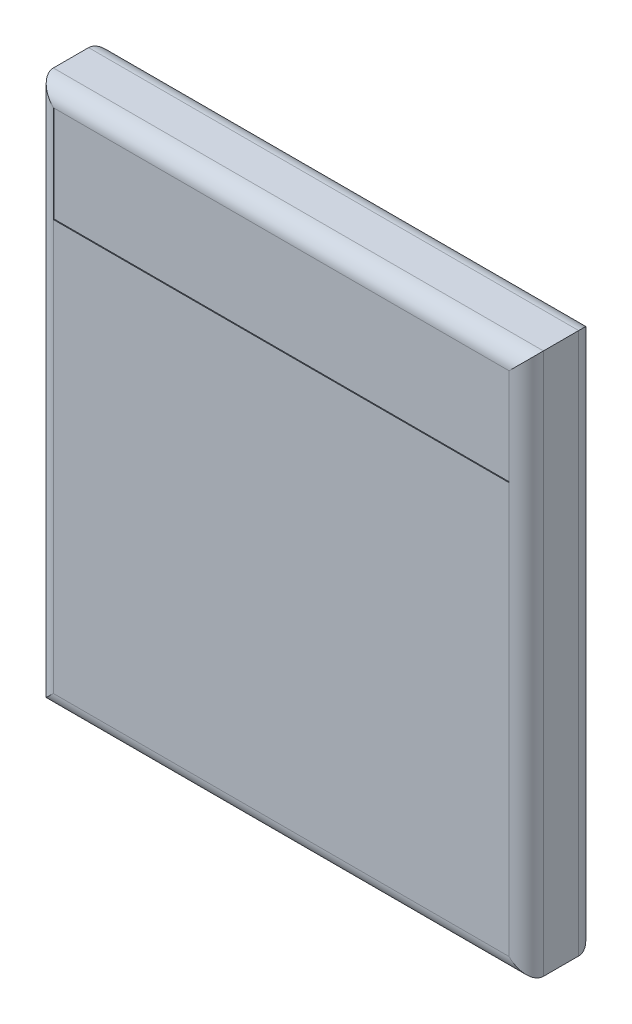
from build123d import *

# Parameters (mm, degrees)
BOSS_EXTRU_1_DEPTH      = 4.05
BOSS_EXTRU_1_DEPTH_BACK = 4.05
ESQUISSE1_W             = 57
ESQUISSE1_H             = 63
CONG_1_R                = 2
ESQUISSE3_W             = 53
ESQUISSE3_H             = 11.26901874
ENL_V_MAT_EXTRU_1_DEPTH = 0.1
ESQUISSE4_W             = 53
ESQUISSE4_H             = 11.26901874
ENL_V_MAT_EXTRU_2_DEPTH = 0.1
ENL_V_MAT_EXTRU_3_DEPTH = 0.1


with BuildPart() as part:
    # Esquisse1 → Boss.-Extru.1 (new, two sides: drawn at the far end of the back side and taken through both)
    with BuildSketch(Plane.XY.offset(-BOSS_EXTRU_1_DEPTH_BACK)):
        Rectangle(ESQUISSE1_W, ESQUISSE1_H)
    extrude(amount=BOSS_EXTRU_1_DEPTH + BOSS_EXTRU_1_DEPTH_BACK)

    # Congé1
    cong_1_edges = [part.edges().sort_by_distance(p)[0] for p in [
        (28.5, 0, 4.05),
        (-28.5, 0, -4.05),
        (0, 31.5, 4.05),
        (-28.5, 0, 4.05),
        (0, -31.5, 4.05),
        (0, -31.5, -4.05),
        (28.5, 0, -4.05),
        (0, 31.5, -4.05),
    ]]
    fillet(cong_1_edges, radius=CONG_1_R)

    # Esquisse3 → Enlèv. mat.-Extru.1 (cut)
    with BuildSketch(Plane(origin=(0, 0, -4.05), x_dir=(-1, 0, 0), z_dir=(0, 0, -1))):
        with Locations((0, 23.86549063)):
            Rectangle(ESQUISSE3_W, ESQUISSE3_H)
    extrude(amount=-ENL_V_MAT_EXTRU_1_DEPTH, mode=Mode.SUBTRACT)

    # Esquisse4 → Enlèv. mat.-Extru.2 (cut)
    with BuildSketch(Plane.XY.offset(4.05)):
        with Locations((0, 23.86549063)):
            Rectangle(ESQUISSE4_W, ESQUISSE4_H)
    extrude(amount=-ENL_V_MAT_EXTRU_2_DEPTH, mode=Mode.SUBTRACT)

    # Esquisse5 → Enlèv. mat.-Extru.3 (cut)
    # profile 1 of 7: a face of its own
    with BuildSketch(Plane(origin=(0, 0, -4.05), x_dir=(-1, 0, 0), z_dir=(0, 0, -1))):
        with BuildLine():
            Line((-11.232701207, 13.195449506), (-11.546803771, 13.195449506))
            add(Edge.make_bspline(
                [(-11.546803771, 13.195449506), (-11.53829422, 13.23068199), (-11.521658745, 13.299558614), (-11.486961171, 13.397965875), (-11.449161916, 13.491089396), (-11.403772811, 13.57718547), (-11.354264057, 13.657984373), (-11.297541336, 13.731653497), (-11.236221613, 13.800066463), (-11.168396664, 13.8607797), (-11.097268002, 13.915757429), (-11.021833382, 13.962632487), (-10.943610489, 14.00295664), (-10.862057356, 14.036176871), (-10.776931184, 14.061202395), (-10.689001561, 14.079359201), (-10.598038061, 14.091150315), (-10.53629047, 14.092301078), (-10.504936784, 14.092885403)],
                knots=[0, 0, 0, 0, 1.162005537, 2.271625781, 3.343758855, 4.383309926, 5.390229558, 6.379919256, 7.361854164, 8.333198761, 9.295911338, 10.242430842, 11.177959212, 12.116337295, 13.062827104, 14.020064771, 14.994644689, 16, 16, 16, 16], degree=3))
            add(Edge.make_bspline(
                [(-10.504936784, 14.092885403), (-10.459254042, 14.091506173), (-10.368885031, 14.088777797), (-10.236121984, 14.063863361), (-10.108095165, 14.024438229), (-9.986205917, 13.969964501), (-9.872987484, 13.902777188), (-9.772251297, 13.822812451), (-9.685362787, 13.73161315), (-9.612468409, 13.630880586), (-9.55539341, 13.523225076), (-9.513307036, 13.412424919), (-9.487685355, 13.298742948), (-9.484364799, 13.221985668), (-9.482701207, 13.183530435)],
                knots=[0, 0, 0, 0, 1.083050992, 2.142477498, 3.193116406, 4.255571735, 5.30263384, 6.308962982, 7.297363603, 8.282367274, 9.249857812, 10.179914175, 11.08814088, 12, 12, 12, 12], degree=3))
            add(Edge.make_bspline(
                [(-9.482701207, 13.183530435), (-9.483864798, 13.14652364), (-9.486141765, 13.074107086), (-9.50547547, 12.968385589), (-9.538011733, 12.868743989), (-9.583081496, 12.774762826), (-9.641423046, 12.687037987), (-9.712095743, 12.605372096), (-9.795598405, 12.529402938), (-9.858877343, 12.485883465), (-9.891455213, 12.463478352)],
                knots=[0, 0, 0, 0, 1.024540389, 2.004866551, 2.965041327, 3.920577974, 4.882998113, 5.874504559, 6.905732034, 8, 8, 8, 8], degree=3))
            add(Edge.make_bspline(
                [(-9.891455213, 12.463478352), (-9.854223459, 12.44550018), (-9.780456584, 12.409880223), (-9.679906055, 12.340024465), (-9.588628179, 12.259368118), (-9.53772446, 12.196425465), (-9.512148322, 12.164800467)],
                knots=[0, 0, 0, 0, 1.015518401, 2.012035669, 3.001164323, 4, 4, 4, 4], degree=3))
            add(Edge.make_bspline(
                [(-9.512148322, 12.164800467), (-9.49530698, 12.141742716), (-9.461900084, 12.096004799), (-9.42066455, 12.022468373), (-9.383255436, 11.948116884), (-9.354105216, 11.870957478), (-9.331531349, 11.791884464), (-9.315395317, 11.710762068), (-9.305371176, 11.627524046), (-9.303935624, 11.571211565), (-9.303214027, 11.542905435)],
                knots=[0, 0, 0, 0, 1.025084078, 2.033381695, 3.024893161, 4.013698104, 4.991890475, 5.976764909, 6.982997093, 8, 8, 8, 8], degree=3))
            add(Edge.make_bspline(
                [(-9.303214027, 11.542905435), (-9.305008541, 11.493895714), (-9.308589123, 11.396106912), (-9.340593197, 11.25163219), (-9.390206438, 11.110406688), (-9.460663374, 10.975331849), (-9.546530883, 10.848951468), (-9.648688207, 10.735875159), (-9.765974615, 10.638676555), (-9.896780264, 10.557466327), (-10.038497392, 10.492548404), (-10.190072984, 10.447490961), (-10.349323038, 10.418144962), (-10.458530336, 10.414998093), (-10.514051367, 10.413398224)],
                knots=[0, 0, 0, 0, 0.955779014, 1.907060117, 2.875433937, 3.871313158, 4.872415639, 5.851225146, 6.836215519, 7.83643374, 8.849228613, 9.86973379, 10.916971861, 12, 12, 12, 12], degree=3))
            add(Edge.make_bspline(
                [(-10.514051367, 10.413398224), (-10.551470667, 10.414266437), (-10.625099372, 10.415974791), (-10.733342871, 10.427653392), (-10.83666457, 10.448983397), (-10.935204168, 10.477686703), (-11.029049204, 10.514078445), (-11.117913309, 10.559397143), (-11.202343203, 10.612708645), (-11.281542154, 10.674642233), (-11.355500722, 10.743923573), (-11.422253446, 10.821782583), (-11.482913239, 10.906779986), (-11.535855878, 10.999903043), (-11.58349283, 11.0999483), (-11.622673787, 11.208196798), (-11.657159356, 11.32368082), (-11.67319282, 11.40415856), (-11.681419155, 11.445449506)],
                knots=[0, 0, 0, 0, 1.048658725, 2.063410685, 3.046034179, 4.001477787, 4.936774919, 5.862367409, 6.792675028, 7.730719943, 8.675894397, 9.627829632, 10.600096036, 11.597688215, 12.626045268, 13.701542398, 14.82072376, 16, 16, 16, 16], degree=3))
            Line((-11.681419155, 11.445449506), (-11.367316591, 11.445449506))
            add(Edge.make_bspline(
                [(-11.367316591, 11.445449506), (-11.3591333, 11.418500492), (-11.343216087, 11.366082321), (-11.316121789, 11.290642015), (-11.285253517, 11.221483962), (-11.252138958, 11.15810084), (-11.217360512, 11.099868437), (-11.178445587, 11.048326568), (-11.138276442, 11.001211366), (-11.107997089, 10.974666754), (-11.09317797, 10.961675467)],
                knots=[0, 0, 0, 0, 1.198163088, 2.33053128, 3.407730985, 4.417276592, 5.372219308, 6.28897303, 7.162600585, 8, 8, 8, 8], degree=3))
            add(Edge.make_bspline(
                [(-11.09317797, 10.961675467), (-11.073581393, 10.946567133), (-11.03444873, 10.916397102), (-10.970680499, 10.877895473), (-10.903615613, 10.844534448), (-10.831800939, 10.819050752), (-10.756786168, 10.797473091), (-10.677358803, 10.783352572), (-10.594219586, 10.773664401), (-10.537451822, 10.772809469), (-10.508442393, 10.772372583)],
                knots=[0, 0, 0, 0, 0.946170439, 1.889420265, 2.845303464, 3.807233317, 4.801018734, 5.828864929, 6.890507805, 8, 8, 8, 8], degree=3))
            add(Edge.make_bspline(
                [(-10.508442393, 10.772372583), (-10.47568889, 10.772988488), (-10.411642243, 10.774192837), (-10.318187384, 10.785268544), (-10.229279936, 10.801398958), (-10.14590701, 10.82631194), (-10.066976503, 10.857092792), (-9.993594853, 10.895741197), (-9.924798747, 10.941085919), (-9.861469342, 10.992625078), (-9.804523834, 11.049046573), (-9.754384321, 11.108059644), (-9.71175966, 11.169415473), (-9.677376081, 11.233453594), (-9.650225531, 11.299908823), (-9.63174233, 11.368967653), (-9.618890815, 11.440064919), (-9.617844203, 11.488393888), (-9.617316591, 11.512757198)],
                knots=[0, 0, 0, 0, 1.217147791, 2.380027433, 3.494444702, 4.572153297, 5.609568379, 6.639424714, 7.649109417, 8.668170816, 9.669597737, 10.625200337, 11.543417969, 12.441394052, 13.322311151, 14.205496177, 15.095365482, 16, 16, 16, 16], degree=3))
            add(Edge.make_bspline(
                [(-9.617316591, 11.512757198), (-9.618846893, 11.545368537), (-9.621899881, 11.610428945), (-9.645208461, 11.706146519), (-9.683547325, 11.798369932), (-9.737219836, 11.885525722), (-9.802555565, 11.966301623), (-9.878920472, 12.038373106), (-9.9669487, 12.097843197), (-10.047968569, 12.138931853), (-10.119733726, 12.166968929), (-10.18114911, 12.185643893), (-10.249905714, 12.201457549), (-10.325172062, 12.21616982), (-10.407515279, 12.228691168), (-10.496845717, 12.239132984), (-10.593181478, 12.247488025), (-10.659872644, 12.25121912), (-10.694239668, 12.253141813)],
                knots=[0, 0, 0, 0, 1.07054697, 2.135767047, 3.216561865, 4.33974944, 5.486079747, 6.621378074, 7.775625952, 8.963672916, 9.598146892, 10.304877434, 11.070270905, 11.915000392, 12.823868403, 13.805723172, 14.86925407, 16, 16, 16, 16], degree=3))
            Line((-10.694239668, 12.253141813), (-10.694239668, 12.612116172))
            add(Edge.make_bspline(
                [(-10.694239668, 12.612116172), (-10.650938503, 12.612850976), (-10.566122156, 12.614290276), (-10.442227851, 12.631698286), (-10.323754539, 12.655778914), (-10.213327797, 12.692664107), (-10.112679084, 12.735504404), (-10.025359482, 12.785356613), (-9.952592334, 12.840771362), (-9.894731263, 12.902603972), (-9.851202034, 12.968919019), (-9.819375237, 13.038035677), (-9.800574911, 13.110559738), (-9.798065244, 13.160054406), (-9.796803771, 13.184932679)],
                knots=[0, 0, 0, 0, 1.321986639, 2.589447074, 3.816329219, 5.01088745, 6.139805852, 7.153945165, 8.075214402, 8.924034688, 9.728124013, 10.488707548, 11.240355623, 12, 12, 12, 12], degree=3))
            add(Edge.make_bspline(
                [(-9.796803771, 13.184932679), (-9.797218182, 13.203210424), (-9.798042633, 13.239573131), (-9.80843991, 13.2926982), (-9.824063951, 13.344199146), (-9.845543681, 13.393856956), (-9.874293879, 13.44132723), (-9.908699866, 13.487014679), (-9.949667966, 13.530658458), (-9.996613413, 13.571338777), (-10.047025218, 13.610108014), (-10.102274993, 13.643021651), (-10.160696868, 13.671166713), (-10.222355523, 13.694376216), (-10.287451053, 13.711835504), (-10.355677611, 13.724371345), (-10.427165294, 13.732209), (-10.475937026, 13.733337416), (-10.500730053, 13.733911044)],
                knots=[0, 0, 0, 0, 0.884392785, 1.759457502, 2.611959086, 3.489218968, 4.37281399, 5.2945488, 6.255912374, 7.266815255, 8.301784654, 9.332968512, 10.37626691, 11.440494194, 12.520033166, 13.637162961, 14.798855837, 16, 16, 16, 16], degree=3))
            add(Edge.make_bspline(
                [(-10.500730053, 13.733911044), (-10.540581721, 13.732519682), (-10.618421297, 13.729802029), (-10.730636214, 13.705999015), (-10.834955548, 13.668020932), (-10.914694215, 13.622687912), (-10.973576789, 13.577937478), (-11.015653727, 13.538855092), (-11.056974237, 13.495422268), (-11.094819914, 13.444963893), (-11.133093891, 13.390897103), (-11.167938453, 13.330473421), (-11.201798145, 13.265269027), (-11.222200694, 13.219173392), (-11.232701207, 13.195449506)],
                knots=[0, 0, 0, 0, 1.472543308, 2.876219568, 4.221790263, 5.565193594, 6.249813518, 6.953379497, 7.687249741, 8.463570142, 9.283606569, 10.136032583, 11.040678096, 12, 12, 12, 12], degree=3))
        make_face()
    # profile 2 of 7: a face of its own
    with BuildSketch(Plane(origin=(0, 0, -4.05), x_dir=(-1, 0, 0), z_dir=(0, 0, -1))):
        with BuildLine():
            add(Edge.make_bspline(
                [(-8.989111463, 12.25173957), (-8.988783445, 12.307836957), (-8.988146265, 12.416806942), (-8.981057844, 12.575591584), (-8.969282502, 12.724551873), (-8.953145129, 12.863694939), (-8.933507149, 12.993056703), (-8.907291662, 13.11229146), (-8.877478859, 13.221951067), (-8.842926414, 13.322393116), (-8.803938625, 13.414970819), (-8.761504364, 13.50139602), (-8.713939569, 13.581537952), (-8.663962656, 13.656675743), (-8.609550585, 13.725579437), (-8.552251794, 13.7892221), (-8.489829918, 13.84613285), (-8.42440691, 13.897979153), (-8.355390445, 13.943428624), (-8.284747779, 13.983461363), (-8.211992673, 14.01766123), (-8.136926491, 14.044551666), (-8.060223933, 14.066762513), (-7.981616866, 14.081951461), (-7.900975502, 14.091508369), (-7.846544067, 14.092422037), (-7.818939187, 14.092885403)],
                knots=[0, 0, 0, 0, 1.646270934, 3.197905019, 4.663502075, 6.030701355, 7.308322542, 8.50163776, 9.611534131, 10.641858119, 11.616356847, 12.558055219, 13.465016945, 14.349605745, 15.204443733, 16.039544428, 16.859896111, 17.680448484, 18.487036065, 19.28249412, 20.06191084, 20.843045899, 21.620316918, 22.403196591, 23.190181807, 24, 24, 24, 24], degree=3))
            add(Edge.make_bspline(
                [(-7.818939187, 14.092885403), (-7.791103709, 14.092397588), (-7.7357477, 14.091427477), (-7.653907325, 14.082103534), (-7.573957643, 14.066632411), (-7.496239504, 14.044711437), (-7.420114518, 14.01751576), (-7.34617811, 13.983428643), (-7.273971029, 13.943749776), (-7.204640741, 13.897125898), (-7.137426126, 13.845143622), (-7.073978163, 13.786380953), (-7.014291077, 13.721431234), (-6.957615772, 13.65098937), (-6.905560174, 13.573704285), (-6.855986742, 13.490920176), (-6.811614706, 13.401189311), (-6.768880031, 13.306008843), (-6.731993044, 13.202745184), (-6.698726799, 13.091980424), (-6.67184783, 12.972406237), (-6.649458558, 12.844649991), (-6.632113662, 12.708242508), (-6.61948102, 12.563476193), (-6.612807935, 12.410255802), (-6.611551234, 12.305497953), (-6.610906335, 12.25173957)],
                knots=[0, 0, 0, 0, 0.810914788, 1.612654377, 2.396697861, 3.181598691, 3.963628158, 4.749916497, 5.551656086, 6.361998678, 7.18212741, 8.025565596, 8.878627764, 9.750805457, 10.657531673, 11.591944965, 12.560506719, 13.57287815, 14.630710178, 15.753379473, 16.941251878, 18.199788006, 19.531962791, 20.947069417, 22.433333509, 24, 24, 24, 24], degree=3))
            add(Edge.make_bspline(
                [(-6.610906335, 12.25173957), (-6.611557919, 12.198215662), (-6.612827505, 12.09392651), (-6.619406212, 11.941395535), (-6.632364843, 11.797397491), (-6.648574832, 11.661587029), (-6.671025795, 11.53452941), (-6.698630961, 11.415784962), (-6.729281284, 11.30484089), (-6.767116078, 11.202606078), (-6.808526788, 11.107654355), (-6.853581984, 11.018987207), (-6.90185181, 10.935820914), (-6.954440555, 10.858821168), (-7.010493969, 10.78744251), (-7.071211757, 10.722944888), (-7.134882342, 10.663774216), (-7.202294758, 10.611122588), (-7.27270631, 10.565037784), (-7.344665386, 10.523823933), (-7.41944877, 10.490591238), (-7.495361723, 10.462056197), (-7.573490089, 10.440255745), (-7.653736479, 10.42518189), (-7.735692715, 10.414610041), (-7.79109428, 10.413803562), (-7.818939187, 10.413398224)],
                knots=[0, 0, 0, 0, 1.561518951, 3.042555995, 4.452378317, 5.7783523, 7.031515105, 8.214008947, 9.334062868, 10.386615937, 11.391082383, 12.354592575, 13.286541444, 14.194233754, 15.072674879, 15.931287219, 16.775624067, 17.606195743, 18.42308326, 19.229000347, 20.022332153, 20.807536673, 21.593273796, 22.3848459, 23.188221202, 24, 24, 24, 24], degree=3))
            add(Edge.make_bspline(
                [(-7.818939187, 10.413398224), (-7.846543301, 10.413864579), (-7.900973226, 10.414784141), (-7.981625652, 10.424297872), (-8.059908095, 10.439593376), (-8.136206849, 10.46100998), (-8.210913364, 10.487224816), (-8.283009651, 10.5213785), (-8.353297335, 10.560712569), (-8.421588891, 10.60550799), (-8.486601052, 10.656829673), (-8.548699657, 10.713593962), (-8.606324676, 10.777217373), (-8.659958772, 10.846695296), (-8.71093286, 10.921388539), (-8.757822233, 11.002316912), (-8.801193087, 11.089159522), (-8.840836578, 11.182477433), (-8.875985241, 11.283632361), (-8.90703295, 11.393781539), (-8.931547107, 11.513897175), (-8.952530062, 11.643014542), (-8.969454445, 11.781688473), (-8.981008771, 11.929994251), (-8.988150086, 12.08783946), (-8.988785156, 12.196109234), (-8.989111463, 12.25173957)],
                knots=[0, 0, 0, 0, 0.810891512, 1.598919785, 2.382837074, 3.152667961, 3.926044502, 4.706494248, 5.493654104, 6.291793342, 7.103789334, 7.925228297, 8.761435821, 9.622817696, 10.50288917, 11.416980706, 12.369136599, 13.353924996, 14.394355917, 15.514179734, 16.714354668, 17.994756427, 19.357759367, 20.818452758, 22.365282078, 24, 24, 24, 24], degree=3))
        make_face()
        with BuildLine():
            add(Edge.make_bspline(
                [(-8.675008899, 12.253141813), (-8.674889452, 12.206393115), (-8.674657629, 12.11566307), (-8.668601428, 11.983819809), (-8.660351196, 11.86084948), (-8.649709899, 11.746595943), (-8.63390695, 11.641445931), (-8.616200163, 11.544676248), (-8.594652073, 11.456799011), (-8.569157055, 11.3772112), (-8.540117958, 11.304562132), (-8.508412094, 11.236960916), (-8.474351372, 11.17360898), (-8.436232221, 11.115075372), (-8.394717158, 11.061169208), (-8.350743899, 11.010936375), (-8.302671314, 10.966139394), (-8.236167572, 10.912412539), (-8.148371097, 10.856893405), (-8.037750642, 10.808547315), (-7.924082191, 10.778164859), (-7.846930941, 10.774301103), (-7.808422361, 10.772372583)],
                knots=[0, 0, 0, 0, 1.459021318, 2.831673884, 4.118529203, 5.306027144, 6.411944654, 7.436330062, 8.375795394, 9.233974572, 10.042671642, 10.816086306, 11.563610507, 12.285937304, 12.993564865, 13.685989202, 14.367179055, 15.041617293, 16.353048772, 17.594441528, 18.799311195, 20, 20, 20, 20], degree=3))
            add(Edge.make_bspline(
                [(-7.808422361, 10.772372583), (-7.769664689, 10.773970363), (-7.692229366, 10.777162626), (-7.579095571, 10.807961364), (-7.4692653, 10.854430903), (-7.38319336, 10.909378408), (-7.317710817, 10.961706738), (-7.270793827, 11.006321386), (-7.227731778, 11.056277254), (-7.186889703, 11.110176549), (-7.149430628, 11.169049034), (-7.11536749, 11.232611609), (-7.084284142, 11.301040787), (-7.066575096, 11.348810526), (-7.057520918, 11.373233961)],
                knots=[0, 0, 0, 0, 1.353760809, 2.704726607, 4.075137775, 5.516104923, 6.260822281, 7.007110065, 7.778089737, 8.566572457, 9.372053459, 10.217411131, 11.088608312, 12, 12, 12, 12], degree=3))
            add(Edge.make_bspline(
                [(-7.057520918, 11.373233961), (-7.04696915, 11.4044637), (-7.025544537, 11.467873464), (-6.997932762, 11.566237117), (-6.976187363, 11.669439881), (-6.956623997, 11.776864997), (-6.943270941, 11.889304698), (-6.932523128, 12.006411082), (-6.926192441, 12.128272444), (-6.92540769, 12.211067436), (-6.925008899, 12.253141813)],
                knots=[0, 0, 0, 0, 0.884706709, 1.796334032, 2.740027952, 3.714592787, 4.726048262, 5.777819803, 6.87074269, 8, 8, 8, 8], degree=3))
            add(Edge.make_bspline(
                [(-6.925008899, 12.253141813), (-6.925559088, 12.295209386), (-6.926635376, 12.377502551), (-6.930749364, 12.498020731), (-6.941372938, 12.612488492), (-6.953172057, 12.721398965), (-6.970569278, 12.824149268), (-6.989327085, 12.921599573), (-7.014528297, 13.012542598), (-7.041448072, 13.098402179), (-7.072258468, 13.178202834), (-7.106174202, 13.25231662), (-7.142395961, 13.321101345), (-7.181738201, 13.384368287), (-7.223733884, 13.442400829), (-7.269491434, 13.494035424), (-7.317195806, 13.540872392), (-7.384012992, 13.594334961), (-7.471487282, 13.648846657), (-7.580332929, 13.699012417), (-7.693603574, 13.727820709), (-7.770177028, 13.731882396), (-7.808422361, 13.733911044)],
                knots=[0, 0, 0, 0, 1.31362396, 2.569729283, 3.763502607, 4.902122613, 5.988968491, 7.01645872, 7.998833611, 8.933434873, 9.825090667, 10.667526885, 11.477055099, 12.250526234, 12.991942729, 13.710640831, 14.402115721, 15.076753259, 16.378508321, 17.609869233, 18.806226677, 20, 20, 20, 20], degree=3))
            add(Edge.make_bspline(
                [(-7.808422361, 13.733911044), (-7.847132953, 13.731879597), (-7.924624658, 13.727813003), (-8.039072613, 13.69911975), (-8.148776965, 13.649106784), (-8.236019939, 13.594154411), (-8.302883726, 13.5418161), (-8.349966419, 13.496429646), (-8.394112591, 13.446783392), (-8.434780292, 13.392381477), (-8.472869575, 13.333916109), (-8.507850587, 13.270927345), (-8.539367917, 13.20309598), (-8.568452453, 13.130479545), (-8.594025241, 13.050898601), (-8.615119204, 12.963129607), (-8.634606258, 12.866667715), (-8.648401526, 12.760948207), (-8.660665282, 12.646666054), (-8.66854663, 12.523388736), (-8.674677888, 12.391324355), (-8.674896352, 12.300125197), (-8.675008899, 12.253141813)],
                knots=[0, 0, 0, 0, 1.207732386, 2.417664972, 3.655092373, 4.956220595, 5.625982001, 6.301752483, 6.994047911, 7.697131622, 8.419323945, 9.170223765, 9.943494443, 10.752040957, 11.610060368, 12.549350801, 13.567764191, 14.679664412, 15.874934091, 17.154273443, 18.533957287, 20, 20, 20, 20], degree=3))
        make_face(mode=Mode.SUBTRACT)
    # profile 3 of 7: a face of its own
    with BuildSketch(Plane(origin=(0, 0, -4.05), x_dir=(-1, 0, 0), z_dir=(0, 0, -1))):
        with BuildLine():
            add(Edge.make_bspline(
                [(-6.296803771, 12.25173957), (-6.296475753, 12.307836957), (-6.295838573, 12.416806942), (-6.288750152, 12.575591584), (-6.276974809, 12.724551873), (-6.260837437, 12.863694939), (-6.241199456, 12.993056703), (-6.21498397, 13.11229146), (-6.185171167, 13.221951067), (-6.150618721, 13.322393116), (-6.111630932, 13.414970819), (-6.069196672, 13.50139602), (-6.021631877, 13.581537952), (-5.971654964, 13.656675743), (-5.917242893, 13.725579437), (-5.859944102, 13.7892221), (-5.797522226, 13.84613285), (-5.732099218, 13.897979153), (-5.663082753, 13.943428624), (-5.592440087, 13.983461363), (-5.519684981, 14.01766123), (-5.444618798, 14.044551666), (-5.36791624, 14.066762513), (-5.289309174, 14.081951461), (-5.20866781, 14.091508369), (-5.154236375, 14.092422037), (-5.126631495, 14.092885403)],
                knots=[0, 0, 0, 0, 1.646270934, 3.197905019, 4.663502075, 6.030701355, 7.308322542, 8.50163776, 9.611534131, 10.641858119, 11.616356847, 12.558055219, 13.465016945, 14.349605745, 15.204443733, 16.039544428, 16.859896111, 17.680448484, 18.487036065, 19.28249412, 20.06191084, 20.843045899, 21.620316918, 22.403196591, 23.190181807, 24, 24, 24, 24], degree=3))
            add(Edge.make_bspline(
                [(-5.126631495, 14.092885403), (-5.098796017, 14.092397588), (-5.043440008, 14.091427477), (-4.961599633, 14.082103534), (-4.881649951, 14.066632411), (-4.803931812, 14.044711437), (-4.727806826, 14.01751576), (-4.653870418, 13.983428643), (-4.581663336, 13.943749776), (-4.512333049, 13.897125898), (-4.445118433, 13.845143622), (-4.381670471, 13.786380953), (-4.321983385, 13.721431234), (-4.265308079, 13.65098937), (-4.213252482, 13.573704285), (-4.16367905, 13.490920176), (-4.119307014, 13.401189311), (-4.076572339, 13.306008843), (-4.039685352, 13.202745184), (-4.006419107, 13.091980424), (-3.979540138, 12.972406237), (-3.957150866, 12.844649991), (-3.93980597, 12.708242508), (-3.927173328, 12.563476193), (-3.920500243, 12.410255802), (-3.919243542, 12.305497953), (-3.918598643, 12.25173957)],
                knots=[0, 0, 0, 0, 0.810914788, 1.612654377, 2.396697861, 3.181598691, 3.963628158, 4.749916497, 5.551656086, 6.361998678, 7.18212741, 8.025565596, 8.878627764, 9.750805457, 10.657531673, 11.591944965, 12.560506719, 13.57287815, 14.630710178, 15.753379473, 16.941251878, 18.199788006, 19.531962791, 20.947069417, 22.433333509, 24, 24, 24, 24], degree=3))
            add(Edge.make_bspline(
                [(-3.918598643, 12.25173957), (-3.919250227, 12.198215662), (-3.920519813, 12.09392651), (-3.92709852, 11.941395535), (-3.940057151, 11.797397491), (-3.956267139, 11.661587029), (-3.978718102, 11.53452941), (-4.006323269, 11.415784962), (-4.036973591, 11.30484089), (-4.074808385, 11.202606078), (-4.116219096, 11.107654355), (-4.161274292, 11.018987207), (-4.209544118, 10.935820914), (-4.262132863, 10.858821168), (-4.318186276, 10.78744251), (-4.378904065, 10.722944888), (-4.44257465, 10.663774216), (-4.509987066, 10.611122588), (-4.580398617, 10.565037784), (-4.652357694, 10.523823933), (-4.727141077, 10.490591238), (-4.80305403, 10.462056197), (-4.881182396, 10.440255745), (-4.961428787, 10.42518189), (-5.043385023, 10.414610041), (-5.098786588, 10.413803562), (-5.126631495, 10.413398224)],
                knots=[0, 0, 0, 0, 1.561518951, 3.042555995, 4.452378317, 5.7783523, 7.031515105, 8.214008947, 9.334062868, 10.386615937, 11.391082383, 12.354592575, 13.286541444, 14.194233754, 15.072674879, 15.931287219, 16.775624067, 17.606195743, 18.42308326, 19.229000347, 20.022332153, 20.807536673, 21.593273796, 22.3848459, 23.188221202, 24, 24, 24, 24], degree=3))
            add(Edge.make_bspline(
                [(-5.126631495, 10.413398224), (-5.154235609, 10.413864579), (-5.208665534, 10.414784141), (-5.289317959, 10.424297872), (-5.367600403, 10.439593376), (-5.443899157, 10.46100998), (-5.518605672, 10.487224816), (-5.590701959, 10.5213785), (-5.660989642, 10.560712569), (-5.729281198, 10.60550799), (-5.794293359, 10.656829673), (-5.856391965, 10.713593962), (-5.914016984, 10.777217373), (-5.967651079, 10.846695296), (-6.018625168, 10.921388539), (-6.065514541, 11.002316912), (-6.108885395, 11.089159522), (-6.148528886, 11.182477433), (-6.183677549, 11.283632361), (-6.214725257, 11.393781539), (-6.239239415, 11.513897175), (-6.26022237, 11.643014542), (-6.277146753, 11.781688473), (-6.288701078, 11.929994251), (-6.295842393, 12.08783946), (-6.296477464, 12.196109234), (-6.296803771, 12.25173957)],
                knots=[0, 0, 0, 0, 0.810891512, 1.598919785, 2.382837074, 3.152667961, 3.926044502, 4.706494248, 5.493654104, 6.291793342, 7.103789334, 7.925228297, 8.761435821, 9.622817696, 10.50288917, 11.416980706, 12.369136599, 13.353924996, 14.394355917, 15.514179734, 16.714354668, 17.994756427, 19.357759367, 20.818452758, 22.365282078, 24, 24, 24, 24], degree=3))
        make_face()
        with BuildLine():
            add(Edge.make_bspline(
                [(-5.982701207, 12.253141813), (-5.98258176, 12.206393115), (-5.982349936, 12.11566307), (-5.976293736, 11.983819809), (-5.968043504, 11.86084948), (-5.957402207, 11.746595943), (-5.941599258, 11.641445931), (-5.92389247, 11.544676248), (-5.902344381, 11.456799011), (-5.876849363, 11.3772112), (-5.847810266, 11.304562132), (-5.816104402, 11.236960916), (-5.782043679, 11.17360898), (-5.743924529, 11.115075372), (-5.702409465, 11.061169208), (-5.658436206, 11.010936375), (-5.610363622, 10.966139394), (-5.54385988, 10.912412539), (-5.456063405, 10.856893405), (-5.34544295, 10.808547315), (-5.231774499, 10.778164859), (-5.154623249, 10.774301103), (-5.116114668, 10.772372583)],
                knots=[0, 0, 0, 0, 1.459021318, 2.831673884, 4.118529203, 5.306027144, 6.411944654, 7.436330062, 8.375795394, 9.233974572, 10.042671642, 10.816086306, 11.563610507, 12.285937304, 12.993564865, 13.685989202, 14.367179055, 15.041617293, 16.353048772, 17.594441528, 18.799311195, 20, 20, 20, 20], degree=3))
            add(Edge.make_bspline(
                [(-5.116114668, 10.772372583), (-5.077356997, 10.773970363), (-4.999921673, 10.777162626), (-4.886787878, 10.807961364), (-4.776957608, 10.854430903), (-4.690885668, 10.909378408), (-4.625403124, 10.961706738), (-4.578486134, 11.006321386), (-4.535424086, 11.056277254), (-4.494582011, 11.110176549), (-4.457122935, 11.169049034), (-4.423059798, 11.232611609), (-4.39197645, 11.301040787), (-4.374267404, 11.348810526), (-4.365213226, 11.373233961)],
                knots=[0, 0, 0, 0, 1.353760809, 2.704726607, 4.075137775, 5.516104923, 6.260822281, 7.007110065, 7.778089737, 8.566572457, 9.372053459, 10.217411131, 11.088608312, 12, 12, 12, 12], degree=3))
            add(Edge.make_bspline(
                [(-4.365213226, 11.373233961), (-4.354661458, 11.4044637), (-4.333236844, 11.467873464), (-4.30562507, 11.566237117), (-4.283879671, 11.669439881), (-4.264316305, 11.776864997), (-4.250963249, 11.889304698), (-4.240215436, 12.006411082), (-4.233884749, 12.128272444), (-4.233099998, 12.211067436), (-4.232701207, 12.253141813)],
                knots=[0, 0, 0, 0, 0.884706709, 1.796334032, 2.740027952, 3.714592787, 4.726048262, 5.777819803, 6.87074269, 8, 8, 8, 8], degree=3))
            add(Edge.make_bspline(
                [(-4.232701207, 12.253141813), (-4.233251396, 12.295209386), (-4.234327684, 12.377502551), (-4.238441671, 12.498020731), (-4.249065246, 12.612488492), (-4.260864365, 12.721398965), (-4.278261586, 12.824149268), (-4.297019393, 12.921599573), (-4.322220605, 13.012542598), (-4.34914038, 13.098402179), (-4.379950776, 13.178202834), (-4.41386651, 13.25231662), (-4.450088269, 13.321101345), (-4.489430509, 13.384368287), (-4.531426192, 13.442400829), (-4.577183741, 13.494035424), (-4.624888114, 13.540872392), (-4.6917053, 13.594334961), (-4.77917959, 13.648846657), (-4.888025237, 13.699012417), (-5.001295881, 13.727820709), (-5.077869335, 13.731882396), (-5.116114668, 13.733911044)],
                knots=[0, 0, 0, 0, 1.31362396, 2.569729283, 3.763502607, 4.902122613, 5.988968491, 7.01645872, 7.998833611, 8.933434873, 9.825090667, 10.667526885, 11.477055099, 12.250526234, 12.991942729, 13.710640831, 14.402115721, 15.076753259, 16.378508321, 17.609869233, 18.806226677, 20, 20, 20, 20], degree=3))
            add(Edge.make_bspline(
                [(-5.116114668, 13.733911044), (-5.15482526, 13.731879597), (-5.232316966, 13.727813003), (-5.346764921, 13.69911975), (-5.456469272, 13.649106784), (-5.543712247, 13.594154411), (-5.610576033, 13.5418161), (-5.657658727, 13.496429646), (-5.701804899, 13.446783392), (-5.742472599, 13.392381477), (-5.780561882, 13.333916109), (-5.815542895, 13.270927345), (-5.847060225, 13.20309598), (-5.876144761, 13.130479545), (-5.901717549, 13.050898601), (-5.922811512, 12.963129607), (-5.942298565, 12.866667715), (-5.956093834, 12.760948207), (-5.96835759, 12.646666054), (-5.976238938, 12.523388736), (-5.982370195, 12.391324355), (-5.98258866, 12.300125197), (-5.982701207, 12.253141813)],
                knots=[0, 0, 0, 0, 1.207732386, 2.417664972, 3.655092373, 4.956220595, 5.625982001, 6.301752483, 6.994047911, 7.697131622, 8.419323945, 9.170223765, 9.943494443, 10.752040957, 11.610060368, 12.549350801, 13.567764191, 14.679664412, 15.874934091, 17.154273443, 18.533957287, 20, 20, 20, 20], degree=3))
        make_face(mode=Mode.SUBTRACT)
    # profile 4 of 7: a face of its own
    with BuildSketch(Plane(origin=(0, 0, -4.05), x_dir=(-1, 0, 0), z_dir=(0, 0, -1))):
        with BuildLine():
            add(Edge.make_bspline(
                [(-3.604496078, 12.25173957), (-3.60416806, 12.307836957), (-3.60353088, 12.416806942), (-3.596442459, 12.575591584), (-3.584667117, 12.724551873), (-3.568529744, 12.863694939), (-3.548891764, 12.993056703), (-3.522676277, 13.11229146), (-3.492863475, 13.221951067), (-3.458311029, 13.322393116), (-3.41932324, 13.414970819), (-3.376888979, 13.50139602), (-3.329324185, 13.581537952), (-3.279347272, 13.656675743), (-3.2249352, 13.725579437), (-3.16763641, 13.7892221), (-3.105214534, 13.84613285), (-3.039791525, 13.897979153), (-2.970775061, 13.943428624), (-2.900132395, 13.983461363), (-2.827377289, 14.01766123), (-2.752311106, 14.044551666), (-2.675608548, 14.066762513), (-2.597001481, 14.081951461), (-2.516360117, 14.091508369), (-2.461928683, 14.092422037), (-2.434323803, 14.092885403)],
                knots=[0, 0, 0, 0, 1.646270934, 3.197905019, 4.663502075, 6.030701355, 7.308322542, 8.50163776, 9.611534131, 10.641858119, 11.616356847, 12.558055219, 13.465016945, 14.349605745, 15.204443733, 16.039544428, 16.859896111, 17.680448484, 18.487036065, 19.28249412, 20.06191084, 20.843045899, 21.620316918, 22.403196591, 23.190181807, 24, 24, 24, 24], degree=3))
            add(Edge.make_bspline(
                [(-2.434323803, 14.092885403), (-2.406488324, 14.092397588), (-2.351132315, 14.091427477), (-2.26929194, 14.082103534), (-2.189342258, 14.066632411), (-2.11162412, 14.044711437), (-2.035499133, 14.01751576), (-1.961562726, 13.983428643), (-1.889355644, 13.943749776), (-1.820025357, 13.897125898), (-1.752810741, 13.845143622), (-1.689362778, 13.786380953), (-1.629675692, 13.721431234), (-1.573000387, 13.65098937), (-1.52094479, 13.573704285), (-1.471371357, 13.490920176), (-1.426999322, 13.401189311), (-1.384264646, 13.306008843), (-1.34737766, 13.202745184), (-1.314111414, 13.091980424), (-1.287232446, 12.972406237), (-1.264843173, 12.844649991), (-1.247498278, 12.708242508), (-1.234865635, 12.563476193), (-1.22819255, 12.410255802), (-1.226935849, 12.305497953), (-1.22629095, 12.25173957)],
                knots=[0, 0, 0, 0, 0.810914788, 1.612654377, 2.396697861, 3.181598691, 3.963628158, 4.749916497, 5.551656086, 6.361998678, 7.18212741, 8.025565596, 8.878627764, 9.750805457, 10.657531673, 11.591944965, 12.560506719, 13.57287815, 14.630710178, 15.753379473, 16.941251878, 18.199788006, 19.531962791, 20.947069417, 22.433333509, 24, 24, 24, 24], degree=3))
            add(Edge.make_bspline(
                [(-1.22629095, 12.25173957), (-1.226942535, 12.198215662), (-1.228212121, 12.09392651), (-1.234790827, 11.941395535), (-1.247749459, 11.797397491), (-1.263959447, 11.661587029), (-1.28641041, 11.53452941), (-1.314015576, 11.415784962), (-1.344665899, 11.30484089), (-1.382500693, 11.202606078), (-1.423911403, 11.107654355), (-1.4689666, 11.018987207), (-1.517236426, 10.935820914), (-1.569825171, 10.858821168), (-1.625878584, 10.78744251), (-1.686596373, 10.722944888), (-1.750266958, 10.663774216), (-1.817679374, 10.611122588), (-1.888090925, 10.565037784), (-1.960050002, 10.523823933), (-2.034833385, 10.490591238), (-2.110746338, 10.462056197), (-2.188874704, 10.440255745), (-2.269121095, 10.42518189), (-2.351077331, 10.414610041), (-2.406478896, 10.413803562), (-2.434323803, 10.413398224)],
                knots=[0, 0, 0, 0, 1.561518951, 3.042555995, 4.452378317, 5.7783523, 7.031515105, 8.214008947, 9.334062868, 10.386615937, 11.391082383, 12.354592575, 13.286541444, 14.194233754, 15.072674879, 15.931287219, 16.775624067, 17.606195743, 18.42308326, 19.229000347, 20.022332153, 20.807536673, 21.593273796, 22.3848459, 23.188221202, 24, 24, 24, 24], degree=3))
            add(Edge.make_bspline(
                [(-2.434323803, 10.413398224), (-2.461927917, 10.413864579), (-2.516357842, 10.414784141), (-2.597010267, 10.424297872), (-2.67529271, 10.439593376), (-2.751591465, 10.46100998), (-2.82629798, 10.487224816), (-2.898394266, 10.5213785), (-2.96868195, 10.560712569), (-3.036973506, 10.60550799), (-3.101985667, 10.656829673), (-3.164084272, 10.713593962), (-3.221709291, 10.777217373), (-3.275343387, 10.846695296), (-3.326317475, 10.921388539), (-3.373206849, 11.002316912), (-3.416577703, 11.089159522), (-3.456221193, 11.182477433), (-3.491369857, 11.283632361), (-3.522417565, 11.393781539), (-3.546931722, 11.513897175), (-3.567914678, 11.643014542), (-3.584839061, 11.781688473), (-3.596393386, 11.929994251), (-3.603534701, 12.08783946), (-3.604169772, 12.196109234), (-3.604496078, 12.25173957)],
                knots=[0, 0, 0, 0, 0.810891512, 1.598919785, 2.382837074, 3.152667961, 3.926044502, 4.706494248, 5.493654104, 6.291793342, 7.103789334, 7.925228297, 8.761435821, 9.622817696, 10.50288917, 11.416980706, 12.369136599, 13.353924996, 14.394355917, 15.514179734, 16.714354668, 17.994756427, 19.357759367, 20.818452758, 22.365282078, 24, 24, 24, 24], degree=3))
        make_face()
        with BuildLine():
            add(Edge.make_bspline(
                [(-3.290393514, 12.253141813), (-3.290274067, 12.206393115), (-3.290042244, 12.11566307), (-3.283986043, 11.983819809), (-3.275735811, 11.86084948), (-3.265094514, 11.746595943), (-3.249291566, 11.641445931), (-3.231584778, 11.544676248), (-3.210036688, 11.456799011), (-3.18454167, 11.3772112), (-3.155502574, 11.304562132), (-3.12379671, 11.236960916), (-3.089735987, 11.17360898), (-3.051616836, 11.115075372), (-3.010101773, 11.061169208), (-2.966128514, 11.010936375), (-2.91805593, 10.966139394), (-2.851552187, 10.912412539), (-2.763755713, 10.856893405), (-2.653135258, 10.808547315), (-2.539466807, 10.778164859), (-2.462315557, 10.774301103), (-2.423806976, 10.772372583)],
                knots=[0, 0, 0, 0, 1.459021318, 2.831673884, 4.118529203, 5.306027144, 6.411944654, 7.436330062, 8.375795394, 9.233974572, 10.042671642, 10.816086306, 11.563610507, 12.285937304, 12.993564865, 13.685989202, 14.367179055, 15.041617293, 16.353048772, 17.594441528, 18.799311195, 20, 20, 20, 20], degree=3))
            add(Edge.make_bspline(
                [(-2.423806976, 10.772372583), (-2.385049304, 10.773970363), (-2.307613981, 10.777162626), (-2.194480186, 10.807961364), (-2.084649916, 10.854430903), (-1.998577976, 10.909378408), (-1.933095432, 10.961706738), (-1.886178442, 11.006321386), (-1.843116394, 11.056277254), (-1.802274319, 11.110176549), (-1.764815243, 11.169049034), (-1.730752105, 11.232611609), (-1.699668758, 11.301040787), (-1.681959712, 11.348810526), (-1.672905534, 11.373233961)],
                knots=[0, 0, 0, 0, 1.353760809, 2.704726607, 4.075137775, 5.516104923, 6.260822281, 7.007110065, 7.778089737, 8.566572457, 9.372053459, 10.217411131, 11.088608312, 12, 12, 12, 12], degree=3))
            add(Edge.make_bspline(
                [(-1.672905534, 11.373233961), (-1.662353766, 11.4044637), (-1.640929152, 11.467873464), (-1.613317378, 11.566237117), (-1.591571979, 11.669439881), (-1.572008613, 11.776864997), (-1.558655557, 11.889304698), (-1.547907744, 12.006411082), (-1.541577057, 12.128272444), (-1.540792306, 12.211067436), (-1.540393514, 12.253141813)],
                knots=[0, 0, 0, 0, 0.884706709, 1.796334032, 2.740027952, 3.714592787, 4.726048262, 5.777819803, 6.87074269, 8, 8, 8, 8], degree=3))
            add(Edge.make_bspline(
                [(-1.540393514, 12.253141813), (-1.540943704, 12.295209386), (-1.542019991, 12.377502551), (-1.546133979, 12.498020731), (-1.556757554, 12.612488492), (-1.568556672, 12.721398965), (-1.585953894, 12.824149268), (-1.6047117, 12.921599573), (-1.629912913, 13.012542598), (-1.656832688, 13.098402179), (-1.687643083, 13.178202834), (-1.721558817, 13.25231662), (-1.757780576, 13.321101345), (-1.797122817, 13.384368287), (-1.8391185, 13.442400829), (-1.884876049, 13.494035424), (-1.932580422, 13.540872392), (-1.999397608, 13.594334961), (-2.086871897, 13.648846657), (-2.195717545, 13.699012417), (-2.308988189, 13.727820709), (-2.385561643, 13.731882396), (-2.423806976, 13.733911044)],
                knots=[0, 0, 0, 0, 1.31362396, 2.569729283, 3.763502607, 4.902122613, 5.988968491, 7.01645872, 7.998833611, 8.933434873, 9.825090667, 10.667526885, 11.477055099, 12.250526234, 12.991942729, 13.710640831, 14.402115721, 15.076753259, 16.378508321, 17.609869233, 18.806226677, 20, 20, 20, 20], degree=3))
            add(Edge.make_bspline(
                [(-2.423806976, 13.733911044), (-2.462517568, 13.731879597), (-2.540009274, 13.727813003), (-2.654457228, 13.69911975), (-2.76416158, 13.649106784), (-2.851404555, 13.594154411), (-2.918268341, 13.5418161), (-2.965351035, 13.496429646), (-3.009497207, 13.446783392), (-3.050164907, 13.392381477), (-3.08825419, 13.333916109), (-3.123235203, 13.270927345), (-3.154752532, 13.20309598), (-3.183837069, 13.130479545), (-3.209409857, 13.050898601), (-3.23050382, 12.963129607), (-3.249990873, 12.866667715), (-3.263786142, 12.760948207), (-3.276049898, 12.646666054), (-3.283931246, 12.523388736), (-3.290062503, 12.391324355), (-3.290280967, 12.300125197), (-3.290393514, 12.253141813)],
                knots=[0, 0, 0, 0, 1.207732386, 2.417664972, 3.655092373, 4.956220595, 5.625982001, 6.301752483, 6.994047911, 7.697131622, 8.419323945, 9.170223765, 9.943494443, 10.752040957, 11.610060368, 12.549350801, 13.567764191, 14.679664412, 15.874934091, 17.154273443, 18.533957287, 20, 20, 20, 20], degree=3))
        make_face(mode=Mode.SUBTRACT)
    # profile 5 of 7: a face of its own
    with BuildSketch(Plane(origin=(0, 0, -4.05), x_dir=(-1, 0, 0), z_dir=(0, 0, -1))):
        with BuildLine():
            Line((0.658324434, 13.060834121), (0.972426998, 13.060834121))
            Line((0.972426998, 13.060834121), (0.972426998, 12.616322903))
            add(Edge.make_bspline(
                [(0.972426998, 12.616322903), (1.000710948, 12.655210505), (1.054905708, 12.729722878), (1.14377136, 12.827913162), (1.232547473, 12.911241317), (1.296480855, 12.954984188), (1.327194627, 12.975998384)],
                knots=[0, 0, 0, 0, 1.134379233, 2.173579362, 3.122582517, 4, 4, 4, 4], degree=3))
            add(Edge.make_bspline(
                [(1.327194627, 12.975998384), (1.369059289, 12.996003749), (1.452057189, 13.035664962), (1.583476413, 13.075898521), (1.717951083, 13.100623623), (1.808759297, 13.104004996), (1.854438216, 13.105705916)],
                knots=[0, 0, 0, 0, 1.014936303, 2.012140481, 3.000054389, 4, 4, 4, 4], degree=3))
            add(Edge.make_bspline(
                [(1.854438216, 13.105705916), (1.885331213, 13.104660625), (1.946466792, 13.102592051), (2.037050882, 13.089132016), (2.124909494, 13.065865843), (2.209523523, 13.033458519), (2.289244203, 12.994211832), (2.3623334, 12.948162124), (2.427957608, 12.896465048), (2.48608366, 12.836786116), (2.538352685, 12.767449517), (2.586431532, 12.686585268), (2.630856744, 12.592377607), (2.655478053, 12.524011066), (2.66844062, 12.488017615)],
                knots=[0, 0, 0, 0, 1.009824226, 1.998387844, 2.986035974, 3.974953746, 4.955485308, 5.885931332, 6.793869504, 7.679848016, 8.601185859, 9.625726857, 10.749998409, 12, 12, 12, 12], degree=3))
            add(Edge.make_bspline(
                [(2.66844062, 12.488017615), (2.682151872, 12.512742034), (2.709133689, 12.561396219), (2.754439326, 12.630254481), (2.801907122, 12.694661273), (2.851941615, 12.754667697), (2.904366202, 12.809977428), (2.959427602, 12.860773329), (3.016812384, 12.907273543), (3.096604624, 12.961596703), (3.200417231, 13.019297884), (3.331305346, 13.069326328), (3.467455517, 13.100242456), (3.559873216, 13.103872729), (3.606541582, 13.105705916)],
                knots=[0, 0, 0, 0, 0.86119277, 1.694706429, 2.50939023, 3.298075842, 4.073795165, 4.829715201, 5.57930267, 6.321991688, 7.768977793, 9.186738141, 10.579381044, 12, 12, 12, 12], degree=3))
            add(Edge.make_bspline(
                [(3.606541582, 13.105705916), (3.649423045, 13.104088695), (3.733346231, 13.100923637), (3.855523497, 13.076070163), (3.969465302, 13.033392516), (4.074942378, 12.97515888), (4.170102191, 12.901979696), (4.252818501, 12.814910859), (4.322588864, 12.714568236), (4.368167504, 12.620176247), (4.399082768, 12.536840914), (4.418144002, 12.465834623), (4.434983697, 12.38768307), (4.448964943, 12.302292809), (4.459183495, 12.2093622), (4.46675421, 12.109043324), (4.471878284, 12.001258213), (4.472240356, 11.926892713), (4.472426998, 11.88855848)],
                knots=[0, 0, 0, 0, 1.209669288, 2.367440248, 3.500751976, 4.631527125, 5.755587489, 6.87532382, 8.007944318, 9.190864318, 9.82315674, 10.514484317, 11.263564316, 12.079023757, 12.955305781, 13.901327259, 14.918167583, 16, 16, 16, 16], degree=3))
            Line((4.472426998, 11.88855848), (4.472426998, 10.503141813))
            Line((4.472426998, 10.503141813), (4.158324434, 10.503141813))
            Line((4.158324434, 10.503141813), (4.158324434, 11.889960724))
            add(Edge.make_bspline(
                [(4.158324434, 11.889960724), (4.158246551, 11.922681298), (4.158096872, 11.985565264), (4.155403241, 12.075817716), (4.150327927, 12.158086073), (4.144393288, 12.232258161), (4.136149478, 12.298506949), (4.125503547, 12.356699368), (4.114225867, 12.407293179), (4.095489876, 12.463379227), (4.065541984, 12.525249437), (4.019924504, 12.591973013), (3.962454398, 12.650053813), (3.896094241, 12.70047213), (3.820545796, 12.741465771), (3.737281073, 12.770741781), (3.646817022, 12.78886466), (3.584194233, 12.790670675), (3.551854082, 12.791603352)],
                knots=[0, 0, 0, 0, 1.253487763, 2.409012846, 3.458416907, 4.410876679, 5.259312806, 6.014470957, 6.676830364, 7.243083969, 8.276244668, 9.299465089, 10.325150304, 11.392391894, 12.482080715, 13.603491619, 14.762376348, 16, 16, 16, 16], degree=3))
            add(Edge.make_bspline(
                [(3.551854082, 12.791603352), (3.512184127, 12.790187194), (3.433781216, 12.787388329), (3.31933573, 12.758814456), (3.209364713, 12.715734205), (3.10714958, 12.653301748), (3.01312179, 12.578493384), (2.932222212, 12.489543789), (2.865390026, 12.388913862), (2.82013605, 12.295767159), (2.791546749, 12.212097716), (2.772669833, 12.139000344), (2.757986442, 12.055918776), (2.744215913, 11.963411285), (2.735228185, 11.860841105), (2.727059813, 11.748682704), (2.72323895, 11.626598744), (2.722704491, 11.541972055), (2.722426998, 11.49803364)],
                knots=[0, 0, 0, 0, 1.090531906, 2.155305635, 3.229839962, 4.33261226, 5.44038871, 6.529323825, 7.629011124, 8.757537029, 9.370236727, 10.061839251, 10.834451254, 11.692844982, 12.636905849, 13.66920014, 14.789842145, 16, 16, 16, 16], degree=3))
            Line((2.722426998, 11.49803364), (2.722426998, 10.503141813))
            Line((2.722426998, 10.503141813), (2.408324434, 10.503141813))
            Line((2.408324434, 10.503141813), (2.408324434, 11.803722743))
            add(Edge.make_bspline(
                [(2.408324434, 11.803722743), (2.408245003, 11.840416062), (2.408092186, 11.911010319), (2.405415869, 12.012243994), (2.400329247, 12.104325074), (2.394448699, 12.187146538), (2.38598852, 12.260557867), (2.376378758, 12.324952625), (2.365030148, 12.380169376), (2.346240263, 12.440732761), (2.317525795, 12.507453684), (2.271337533, 12.578594705), (2.213729952, 12.640862802), (2.146159076, 12.694021551), (2.070153394, 12.737963032), (1.986169993, 12.769622784), (1.894965081, 12.788047074), (1.832087375, 12.79039557), (1.799750716, 12.791603352)],
                knots=[0, 0, 0, 0, 1.320475261, 2.540461679, 3.643808994, 4.639130445, 5.527981419, 6.302341397, 6.981980563, 7.553956391, 8.582137848, 9.585246428, 10.591171744, 11.620968678, 12.668337649, 13.738356861, 14.836885341, 16, 16, 16, 16], degree=3))
            add(Edge.make_bspline(
                [(1.799750716, 12.791603352), (1.761734505, 12.790072892), (1.685969546, 12.787022739), (1.574667576, 12.759568465), (1.467181892, 12.716564391), (1.365227193, 12.656904572), (1.271553045, 12.583005493), (1.189544778, 12.496090597), (1.120602252, 12.397241564), (1.074870437, 12.305077047), (1.045371963, 12.223503772), (1.025776629, 12.154152825), (1.008937003, 12.077152576), (0.996422981, 11.992265465), (0.984342566, 11.900044371), (0.978512256, 11.800029881), (0.972840694, 11.692307794), (0.97256828, 11.617935249), (0.972426998, 11.579363768)],
                knots=[0, 0, 0, 0, 1.098833095, 2.189935336, 3.297829714, 4.440610912, 5.596351641, 6.740013378, 7.886572111, 9.072425424, 9.705826452, 10.395263256, 11.156850408, 11.985370555, 12.878090359, 13.847760091, 14.883794034, 16, 16, 16, 16], degree=3))
            Line((0.972426998, 11.579363768), (0.972426998, 10.503141813))
            Line((0.972426998, 10.503141813), (0.658324434, 10.503141813))
            Line((0.658324434, 10.503141813), (0.658324434, 13.060834121))
        make_face()
    # profile 6 of 7: a face of its own
    with BuildSketch(Plane(origin=(0, 0, -4.05), x_dir=(-1, 0, 0), z_dir=(0, 0, -1))):
        Polygon((6.716016742, 14.003141813), (8.331401357, 10.503141813), (7.989955043, 10.503141813), (7.472527159, 11.624936685), (5.885888537, 11.624936685), (5.353737095, 10.503141813), (5.010888537, 10.503141813), (6.671144947, 14.003141813), align=None)
        Polygon((6.690075236, 13.320950307), (6.056261133, 11.983911044), (7.307062415, 11.983911044), align=None, mode=Mode.SUBTRACT)
    # profile 7 of 7: a face of its own
    with BuildSketch(Plane(origin=(0, 0, -4.05), x_dir=(-1, 0, 0), z_dir=(0, 0, -1))):
        with BuildLine():
            Line((8.869862896, 14.092885403), (9.18396546, 14.092885403))
            Line((9.18396546, 14.092885403), (9.18396546, 12.577761204))
            add(Edge.make_bspline(
                [(9.18396546, 12.577761204), (9.217682762, 12.619905186), (9.283332076, 12.701961679), (9.393828192, 12.80902287), (9.507299064, 12.901821491), (9.627663874, 12.975691948), (9.752714395, 13.034048492), (9.882978039, 13.075436138), (10.01847901, 13.100887235), (10.11050416, 13.104085653), (10.157122511, 13.105705916)],
                knots=[0, 0, 0, 0, 1.125788106, 2.19196713, 3.20547328, 4.180437432, 5.132270164, 6.079753143, 7.027236121, 8, 8, 8, 8], degree=3))
            add(Edge.make_bspline(
                [(10.157122511, 13.105705916), (10.204452904, 13.103960486), (10.2970899, 13.100544258), (10.431971362, 13.073530877), (10.557932237, 13.027373438), (10.67459808, 12.964206413), (10.779422777, 12.885533586), (10.872272541, 12.794702064), (10.94811334, 12.689428145), (10.999712457, 12.592171891), (11.033285865, 12.505633137), (11.054537691, 12.431396625), (11.07255689, 12.348674712), (11.088256625, 12.25750998), (11.098720207, 12.157464808), (11.107124825, 12.048990554), (11.113101279, 11.932093436), (11.113332884, 11.851173186), (11.113452639, 11.809331717)],
                knots=[0, 0, 0, 0, 1.235656852, 2.418478516, 3.575258207, 4.727955599, 5.870717718, 6.98870536, 8.107142894, 9.245821548, 9.854588956, 10.528768408, 11.260415777, 12.065282286, 12.943670737, 13.886611085, 14.907229059, 16, 16, 16, 16], degree=3))
            Line((11.113452639, 11.809331717), (11.113452639, 10.503141813))
            Line((11.113452639, 10.503141813), (10.799350075, 10.503141813))
            Line((10.799350075, 10.503141813), (10.799350075, 11.706266813))
            add(Edge.make_bspline(
                [(10.799350075, 11.706266813), (10.799159772, 11.741089483), (10.798795755, 11.807699323), (10.79759241, 11.903065432), (10.794906195, 11.989561566), (10.790565369, 12.066910518), (10.786000062, 12.135220121), (10.779716744, 12.194391176), (10.77240651, 12.244504951), (10.765837729, 12.27466958), (10.762891742, 12.288197903)],
                knots=[0, 0, 0, 0, 1.430932559, 2.737130458, 3.918967929, 4.986496826, 5.920444988, 6.731744033, 7.431208747, 8, 8, 8, 8], degree=3))
            add(Edge.make_bspline(
                [(10.762891742, 12.288197903), (10.751467497, 12.327892167), (10.729504452, 12.404204157), (10.678456475, 12.507866568), (10.614697464, 12.596251308), (10.536850202, 12.668165596), (10.446291838, 12.724577136), (10.342431874, 12.763644918), (10.226247806, 12.78789264), (10.144396334, 12.790331943), (10.101733889, 12.791603352)],
                knots=[0, 0, 0, 0, 1.090059168, 2.095632401, 3.037101401, 3.955032261, 4.878929692, 5.839099886, 6.873700383, 8, 8, 8, 8], degree=3))
            add(Edge.make_bspline(
                [(10.101733889, 12.791603352), (10.076466116, 12.791127525), (10.026461846, 12.790185878), (9.95231318, 12.780731979), (9.880384117, 12.76528326), (9.809981939, 12.744378722), (9.742598741, 12.715933185), (9.676270416, 12.683002996), (9.612876207, 12.642694741), (9.55129039, 12.597468973), (9.493972857, 12.547399214), (9.440645742, 12.494552259), (9.393107401, 12.438277294), (9.35003881, 12.379477178), (9.312860525, 12.317345385), (9.280407443, 12.252481067), (9.252871746, 12.184798921), (9.239189054, 12.137823859), (9.232342864, 12.114319698)],
                knots=[0, 0, 0, 0, 1.024319606, 2.027102035, 3.025350316, 4.005802111, 5.00026367, 5.987881639, 7.005602596, 8.042517216, 9.083927026, 10.089214625, 11.084353441, 12.06828073, 13.041928858, 14.016821737, 15.00770877, 16, 16, 16, 16], degree=3))
            add(Edge.make_bspline(
                [(9.232342864, 12.114319698), (9.228403437, 12.097298747), (9.21981894, 12.060208), (9.210504106, 11.999033676), (9.20216631, 11.927947304), (9.19511776, 11.847056704), (9.190794674, 11.756065462), (9.186136433, 11.655594502), (9.184402419, 11.545014482), (9.184115466, 11.468118974), (9.18396546, 11.427921461)],
                knots=[0, 0, 0, 0, 0.607992626, 1.324890765, 2.152360218, 3.099583803, 4.150613268, 5.323148443, 6.60066238, 8, 8, 8, 8], degree=3))
            Line((9.18396546, 11.427921461), (9.18396546, 10.503141813))
            Line((9.18396546, 10.503141813), (8.869862896, 10.503141813))
            Line((8.869862896, 10.503141813), (8.869862896, 14.092885403))
        make_face()
    extrude(amount=-ENL_V_MAT_EXTRU_3_DEPTH, mode=Mode.SUBTRACT)


solid = part.part
